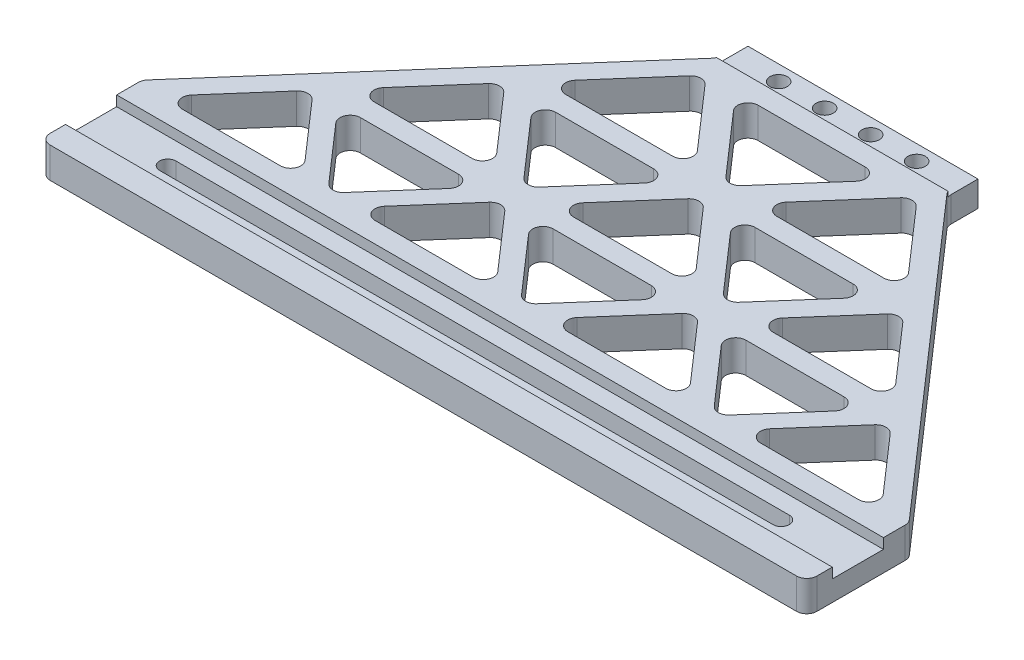
from build123d import *

# Parameters (mm, degrees)
EXTRUDE_1_DEPTH     = 6
SKETCH_2_W          = 150
SKETCH_2_H          = 10
CUT_EXTRUDE_1_DEPTH = 2
FILLET_3_R          = 2
SKETCH_3_W          = 47
SKETCH_3_H          = 6
CUT_EXTRUDE_2_DEPTH = 1
HOLE_WIZARD_M31_D   = 3.4
CUT_EXTRUDE_3_DEPTH = 112.937482552
CUT_EXTRUDE_4_REACH = 114.027
FILLET_1_R          = 2


with BuildPart() as part:
    # Эскиз1 → Бобышка-Вытянуть1 (new body)
    with BuildSketch(Plane(origin=(0, 0, 0), x_dir=(1, 0, 0), z_dir=(0, 1, 0))):
        Polygon((-22.5, 3), (22.5, 3), (22.5, -3), (75, -63), (75, -83), (-75, -83), (-75, -63), (-22.5, -3), align=None)
    extrude(amount=EXTRUDE_1_DEPTH)

    # Эскиз2 → Вырез-Вытянуть1 (cut)
    with BuildSketch(Plane(origin=(0, 6, 0), x_dir=(1, 0, 0), z_dir=(0, 1, 0))):
        with Locations((0, -73)):
            Rectangle(SKETCH_2_W, SKETCH_2_H)
    extrude(amount=-CUT_EXTRUDE_1_DEPTH, mode=Mode.SUBTRACT)

    # Скругление3
    fillet_3_edges = [part.edges().sort_by_distance(p)[0] for p in [
        (-22.5, 3, 3),
        (22.5, 3, 3),
    ]]
    fillet(fillet_3_edges, radius=FILLET_3_R)

    # Эскиз3 → Вырез-Вытянуть2 (cut)
    with BuildSketch(Plane(origin=(0, 6, 0), x_dir=(1, 0, 0), z_dir=(0, 1, 0))):
        Rectangle(SKETCH_3_W, SKETCH_3_H)
    extrude(amount=-CUT_EXTRUDE_2_DEPTH, mode=Mode.SUBTRACT)

    # Отверстие с зазором M31 (through all)
    with Locations(Plane(origin=(0, 0, 0), x_dir=(-1, 0, 0), z_dir=(0, -1, 0))):
        with Locations((-13.5, 0), (-4.5, 0), (4.5, 0), (13.5, 0)):
            Hole(HOLE_WIZARD_M31_D / 2)

    # Эскиз9 → Вырез-Вытянуть3 (cut, through all)
    with BuildSketch(Plane(origin=(0, 4, 0), x_dir=(1, 0, 0), z_dir=(0, 1, 0))):
        with BuildLine():
            Line((-60, -71.4), (60, -71.4))
            ThreePointArc((60, -71.4), (61.6, -73), (60, -74.6))
            Line((60, -74.6), (-60, -74.6))
            ThreePointArc((-60, -74.6), (-61.6, -73), (-60, -71.4))
        make_face()
    extrude(amount=-CUT_EXTRUDE_3_DEPTH, mode=Mode.SUBTRACT)

    # Эскиз10 → Вырез-Вытянуть4 (cut, up to next)
    with BuildSketch(Plane(origin=(0, 6, 0), x_dir=(1, 0, 0), z_dir=(0, 1, 0)), mode=Mode.PRIVATE) as cut_extrude_4_sk1:
        Polygon((-70.559927094, -64), (-56.559927094, -48), (-42.559927094, -64), align=None)
    cut_extrude_4_tool1 = extrude(cut_extrude_4_sk1.sketch, amount=-CUT_EXTRUDE_4_REACH, mode=Mode.PRIVATE) & part.part
    # Эскиз10 → Вырез-Вытянуть4 (cut, up to next)
    with BuildSketch(Plane(origin=(0, 6, 0), x_dir=(1, 0, 0), z_dir=(0, 1, 0)), mode=Mode.PRIVATE) as cut_extrude_4_sk2:
        Polygon((-51.709923067, -48), (-37.709923067, -64), (-23.709923067, -48), align=None)
    cut_extrude_4_tool2 = extrude(cut_extrude_4_sk2.sketch, amount=-CUT_EXTRUDE_4_REACH, mode=Mode.PRIVATE) & part.part
    # Эскиз10 → Вырез-Вытянуть4 (cut, up to next)
    with BuildSketch(Plane(origin=(0, 6, 0), x_dir=(1, 0, 0), z_dir=(0, 1, 0)), mode=Mode.PRIVATE) as cut_extrude_4_sk3:
        Polygon((-18.85991904, -48), (-32.85991904, -64), (-4.85991904, -64), align=None)
    cut_extrude_4_tool3 = extrude(cut_extrude_4_sk3.sketch, amount=-CUT_EXTRUDE_4_REACH, mode=Mode.PRIVATE) & part.part
    # Эскиз10 → Вырез-Вытянуть4 (cut, up to next)
    with BuildSketch(Plane(origin=(0, 6, 0), x_dir=(1, 0, 0), z_dir=(0, 1, 0)), mode=Mode.PRIVATE) as cut_extrude_4_sk4:
        Polygon((-14.009915012, -48), (-0.009915012, -64), (13.990084988, -48), align=None)
    cut_extrude_4_tool4 = extrude(cut_extrude_4_sk4.sketch, amount=-CUT_EXTRUDE_4_REACH, mode=Mode.PRIVATE) & part.part
    # Эскиз10 → Вырез-Вытянуть4 (cut, up to next)
    with BuildSketch(Plane(origin=(0, 6, 0), x_dir=(1, 0, 0), z_dir=(0, 1, 0)), mode=Mode.PRIVATE) as cut_extrude_4_sk5:
        Polygon((18.840089015, -48), (4.840089015, -64), (32.840089015, -64), align=None)
    cut_extrude_4_tool5 = extrude(cut_extrude_4_sk5.sketch, amount=-CUT_EXTRUDE_4_REACH, mode=Mode.PRIVATE) & part.part
    # Эскиз10 → Вырез-Вытянуть4 (cut, up to next)
    with BuildSketch(Plane(origin=(0, 6, 0), x_dir=(1, 0, 0), z_dir=(0, 1, 0)), mode=Mode.PRIVATE) as cut_extrude_4_sk6:
        Polygon((23.690093042, -48), (37.690093042, -64), (51.690093042, -48), align=None)
    cut_extrude_4_tool6 = extrude(cut_extrude_4_sk6.sketch, amount=-CUT_EXTRUDE_4_REACH, mode=Mode.PRIVATE) & part.part
    # Эскиз10 → Вырез-Вытянуть4 (cut, up to next)
    with BuildSketch(Plane(origin=(0, 6, 0), x_dir=(1, 0, 0), z_dir=(0, 1, 0)), mode=Mode.PRIVATE) as cut_extrude_4_sk7:
        Polygon((42.540097069, -64), (70.540097069, -64), (56.540097069, -48), align=None)
    cut_extrude_4_tool7 = extrude(cut_extrude_4_sk7.sketch, amount=-CUT_EXTRUDE_4_REACH, mode=Mode.PRIVATE) & part.part
    # Эскиз10 → Вырез-Вытянуть4 (cut, up to next)
    with BuildSketch(Plane(origin=(0, 6, 0), x_dir=(1, 0, 0), z_dir=(0, 1, 0)), mode=Mode.PRIVATE) as cut_extrude_4_sk8:
        Polygon((-53.059927094, -44), (-39.059927094, -28), (-25.059927094, -44), align=None)
    cut_extrude_4_tool8 = extrude(cut_extrude_4_sk8.sketch, amount=-CUT_EXTRUDE_4_REACH, mode=Mode.PRIVATE) & part.part
    # Эскиз10 → Вырез-Вытянуть4 (cut, up to next)
    with BuildSketch(Plane(origin=(0, 6, 0), x_dir=(1, 0, 0), z_dir=(0, 1, 0)), mode=Mode.PRIVATE) as cut_extrude_4_sk9:
        Polygon((-33.545538953, -28), (-19.545538953, -44), (-5.545538953, -28), align=None)
    cut_extrude_4_tool9 = extrude(cut_extrude_4_sk9.sketch, amount=-CUT_EXTRUDE_4_REACH, mode=Mode.PRIVATE) & part.part
    # Эскиз10 → Вырез-Вытянуть4 (cut, up to next)
    with BuildSketch(Plane(origin=(0, 6, 0), x_dir=(1, 0, 0), z_dir=(0, 1, 0)), mode=Mode.PRIVATE) as cut_extrude_4_sk10:
        Polygon((-0.031150813, -28), (-14.031150813, -44), (13.968849187, -44), align=None)
    cut_extrude_4_tool10 = extrude(cut_extrude_4_sk10.sketch, amount=-CUT_EXTRUDE_4_REACH, mode=Mode.PRIVATE) & part.part
    # Эскиз10 → Вырез-Вытянуть4 (cut, up to next)
    with BuildSketch(Plane(origin=(0, 6, 0), x_dir=(1, 0, 0), z_dir=(0, 1, 0)), mode=Mode.PRIVATE) as cut_extrude_4_sk11:
        Polygon((5.483237327, -28), (19.483237327, -44), (33.483237327, -28), align=None)
    cut_extrude_4_tool11 = extrude(cut_extrude_4_sk11.sketch, amount=-CUT_EXTRUDE_4_REACH, mode=Mode.PRIVATE) & part.part
    # Эскиз10 → Вырез-Вытянуть4 (cut, up to next)
    with BuildSketch(Plane(origin=(0, 6, 0), x_dir=(1, 0, 0), z_dir=(0, 1, 0)), mode=Mode.PRIVATE) as cut_extrude_4_sk12:
        Polygon((24.997625468, -44), (38.997625468, -28), (52.997625468, -44), align=None)
    cut_extrude_4_tool12 = extrude(cut_extrude_4_sk12.sketch, amount=-CUT_EXTRUDE_4_REACH, mode=Mode.PRIVATE) & part.part
    # Эскиз10 → Вырез-Вытянуть4 (cut, up to next)
    with BuildSketch(Plane(origin=(0, 6, 0), x_dir=(1, 0, 0), z_dir=(0, 1, 0)), mode=Mode.PRIVATE) as cut_extrude_4_sk13:
        Polygon((-35.559927094, -24), (-20.684927094, -7), (-5.809927094, -24), align=None)
    cut_extrude_4_tool13 = extrude(cut_extrude_4_sk13.sketch, amount=-CUT_EXTRUDE_4_REACH, mode=Mode.PRIVATE) & part.part
    # Эскиз10 → Вырез-Вытянуть4 (cut, up to next)
    with BuildSketch(Plane(origin=(0, 6, 0), x_dir=(1, 0, 0), z_dir=(0, 1, 0)), mode=Mode.PRIVATE) as cut_extrude_4_sk14:
        Polygon((-14.904785308, -7), (-0.029785308, -24), (14.845214692, -7), align=None)
    cut_extrude_4_tool14 = extrude(cut_extrude_4_sk14.sketch, amount=-CUT_EXTRUDE_4_REACH, mode=Mode.PRIVATE) & part.part
    # Эскиз10 → Вырез-Вытянуть4 (cut, up to next)
    with BuildSketch(Plane(origin=(0, 6, 0), x_dir=(1, 0, 0), z_dir=(0, 1, 0)), mode=Mode.PRIVATE) as cut_extrude_4_sk15:
        Polygon((20.625356478, -7), (5.750356478, -24), (35.500356478, -24), align=None)
    cut_extrude_4_tool15 = extrude(cut_extrude_4_sk15.sketch, amount=-CUT_EXTRUDE_4_REACH, mode=Mode.PRIVATE) & part.part
    add(cut_extrude_4_tool1.solids().sort_by_distance((-56.559927, 6, 58.666667))[0], mode=Mode.SUBTRACT)
    add(cut_extrude_4_tool2.solids().sort_by_distance((-37.709923, 6, 53.333333))[0], mode=Mode.SUBTRACT)
    add(cut_extrude_4_tool3.solids().sort_by_distance((-18.859919, 6, 58.666667))[0], mode=Mode.SUBTRACT)
    add(cut_extrude_4_tool4.solids().sort_by_distance((-0.009915, 6, 53.333333))[0], mode=Mode.SUBTRACT)
    add(cut_extrude_4_tool5.solids().sort_by_distance((18.840089, 6, 58.666667))[0], mode=Mode.SUBTRACT)
    add(cut_extrude_4_tool6.solids().sort_by_distance((37.690093, 6, 53.333333))[0], mode=Mode.SUBTRACT)
    add(cut_extrude_4_tool7.solids().sort_by_distance((56.540097, 6, 58.666667))[0], mode=Mode.SUBTRACT)
    add(cut_extrude_4_tool8.solids().sort_by_distance((-39.059927, 6, 38.666667))[0], mode=Mode.SUBTRACT)
    add(cut_extrude_4_tool9.solids().sort_by_distance((-19.545539, 6, 33.333333))[0], mode=Mode.SUBTRACT)
    add(cut_extrude_4_tool10.solids().sort_by_distance((-0.031151, 6, 38.666667))[0], mode=Mode.SUBTRACT)
    add(cut_extrude_4_tool11.solids().sort_by_distance((19.483237, 6, 33.333333))[0], mode=Mode.SUBTRACT)
    add(cut_extrude_4_tool12.solids().sort_by_distance((38.997625, 6, 38.666667))[0], mode=Mode.SUBTRACT)
    add(cut_extrude_4_tool13.solids().sort_by_distance((-20.684927, 6, 18.333333))[0], mode=Mode.SUBTRACT)
    add(cut_extrude_4_tool14.solids().sort_by_distance((-0.029785, 6, 12.666667))[0], mode=Mode.SUBTRACT)
    add(cut_extrude_4_tool15.solids().sort_by_distance((20.625356, 6, 18.333333))[0], mode=Mode.SUBTRACT)

    # Скругление1
    fillet_1_edges = [part.edges().sort_by_distance(p)[0] for p in [
        (-42.559927094, 3, 64),
        (-70.559927094, 3, 64),
        (-56.559927094, 3, 48),
        (-51.709923067, 3, 48),
        (-23.709923067, 3, 48),
        (-37.709923067, 3, 64),
        (75, 3, 63),
        (75, 3, 83),
        (-75, 3, 83),
        (-75, 3, 63),
        (-18.85991904, 3, 48),
        (-4.85991904, 3, 64),
        (-32.85991904, 3, 64),
        (-14.009915012, 3, 48),
        (13.990084988, 3, 48),
        (-0.009915012, 3, 64),
        (18.840089015, 3, 48),
        (32.840089015, 3, 64),
        (4.840089015, 3, 64),
        (23.690093042, 3, 48),
        (51.690093042, 3, 48),
        (37.690093042, 3, 64),
        (-25.059927094, 3, 44),
        (-53.059927094, 3, 44),
        (-39.059927094, 3, 28),
        (42.540097069, 3, 64),
        (56.540097069, 3, 48),
        (70.540097069, 3, 64),
        (-33.545538953, 3, 28),
        (-5.545538953, 3, 28),
        (-19.545538953, 3, 44),
        (-0.031150813, 3, 28),
        (13.968849187, 3, 44),
        (-14.031150813, 3, 44),
        (5.483237327, 3, 28),
        (33.483237327, 3, 28),
        (19.483237327, 3, 44),
        (52.997625468, 3, 44),
        (24.997625468, 3, 44),
        (38.997625468, 3, 28),
        (-5.809927094, 3, 24),
        (-35.559927094, 3, 24),
        (-20.684927094, 3, 7),
        (-14.904785308, 3, 7),
        (14.845214692, 3, 7),
        (-0.029785308, 3, 24),
        (20.625356478, 3, 7),
        (35.500356478, 3, 24),
        (5.750356478, 3, 24),
    ]]
    fillet(fillet_1_edges, radius=FILLET_1_R)


solid = part.part
